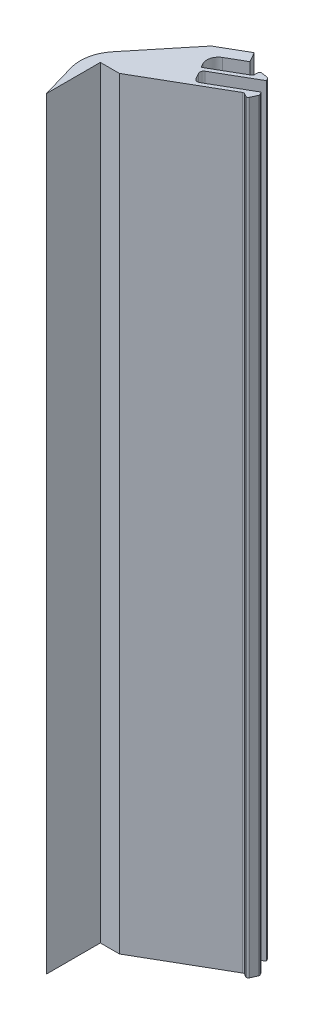
from build123d import *

# Parameters (mm, degrees)
BOSS_EXTRUDE1_DEPTH   = 200
BOSS_EXTRUDE1_2_DEPTH = 200
FILLET1_R             = 0.5
FILLET2_R             = 0.5
BOSS_EXTRUDE3_DEPTH   = 200
FILLET3_R             = 10
FILLET4_R             = 1
FILLET5_R             = 3


with BuildPart() as part:
    # Sketch1 → Boss-Extrude1 (new body)
    with BuildSketch(Plane(origin=(0, 0, 0), x_dir=(1, 0, 0), z_dir=(0, 1, 0))):
        Polygon((13.927082127, 14.175350351), (16.351953258, 13.843299543), (16.851953258, 12.977274139), (3.059579159, 5.014243241), (2.594699496, 5.900545381), (13.927082127, 12.443299543), align=None)
    extrude(amount=BOSS_EXTRUDE1_DEPTH)

    # Fillet2
    fillet2_edges = [part.edges().sort_by_distance(p)[0] for p in [
        (13.927082127, 100, -14.175350351),
        (16.351953258, 100, -13.843299543),
        (13.927082127, 100, -12.443299543),
    ]]
    fillet(fillet2_edges, radius=FILLET2_R)



with BuildPart() as body_2:
    # Sketch1 → Boss-Extrude1 2 (new body)
    with BuildSketch(Plane(origin=(0, 0, 0), x_dir=(1, 0, 0), z_dir=(0, 1, 0))):
        Polygon((18.751953258, 9.686377605), (19.251953258, 8.820352201), (18.153877046, 6.454326797), (16.653877046, 7.320352201), (5.114206816, 0.657920487), (4.719127398, 1.584521817), align=None)
    extrude(amount=BOSS_EXTRUDE1_2_DEPTH)

    # Fillet1
    fillet1_edges = [body_2.edges().sort_by_distance(p)[0] for p in [
        (19.251953258, 100, -8.820352201),
        (18.153877046, 100, -6.454326797),
        (16.653877046, 100, -7.320352201),
    ]]
    fillet(fillet1_edges, radius=FILLET1_R)


with BuildPart() as part_1:
    add(part.part)

    add(body_2.part)  # Boss-Extrude3 merges body 2
    # Sketch2 → Boss-Extrude3 (add)
    with BuildSketch(Plane(origin=(0, 0, 0), x_dir=(1, 0, 0), z_dir=(0, 1, 0))):
        Polygon((8.182648293, 2.429486), (3.232648293, 11.003137498), (10.393111947, 15.137233116), (8.893111947, 17.735309327), (1.732648293, 13.601213709), (-13.163737181, -4.647533202), (-9.075108531, -18.787281313), (-9.075108531, -4.647533202), (-4.075108531, -4.647533202), align=None)
    extrude(amount=BOSS_EXTRUDE3_DEPTH)

    # Fillet3
    fillet3_edges = [part_1.edges().sort_by_distance(p)[0] for p in [
        (-13.163737181, 100, 4.647533202),
    ]]
    fillet(fillet3_edges, radius=FILLET3_R)

    # Fillet4
    fillet4_edges = [part_1.edges().sort_by_distance(p)[0] for p in [
        (5.782648293, 100, -6.586407938),
        (7.682648293, 100, -3.295511404),
    ]]
    fillet(fillet4_edges, radius=FILLET4_R)

    # Fillet5
    fillet5_edges = [part_1.edges().sort_by_distance(p)[0] for p in [
        (3.232648293, 100, -11.003137498),
    ]]
    fillet(fillet5_edges, radius=FILLET5_R)


solid = part_1.part
